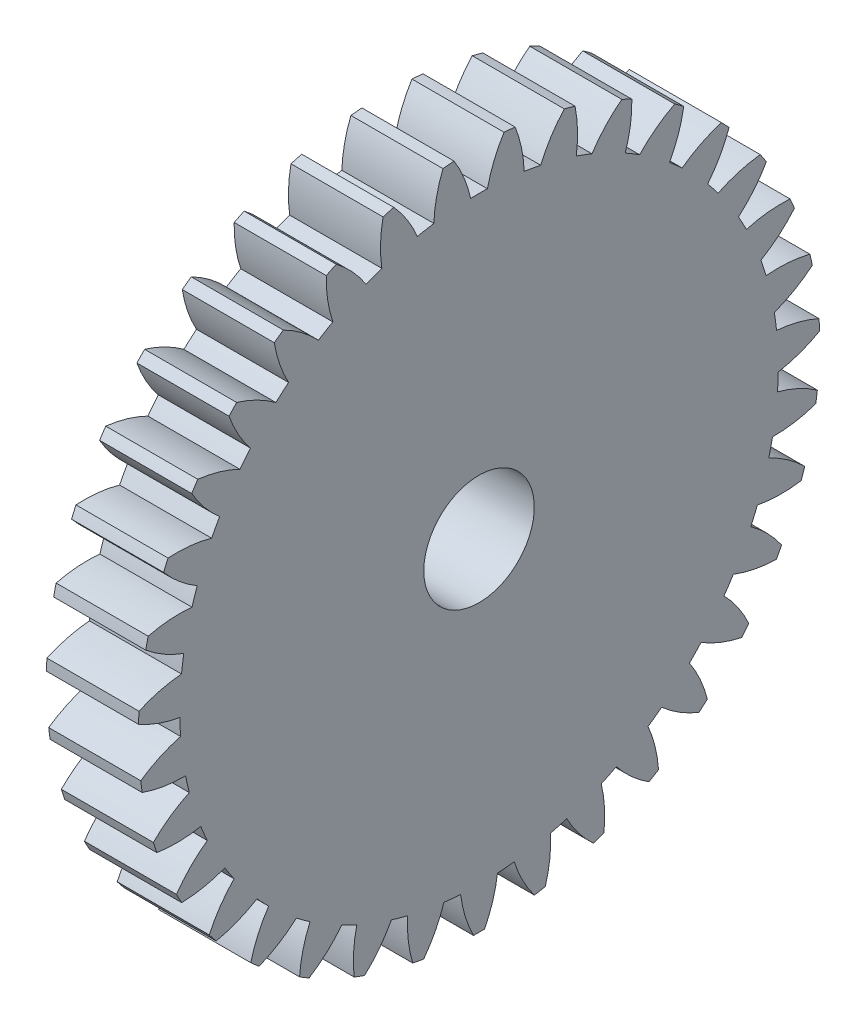
from build123d import *

# Parameters (mm, degrees)
BASPROSKE_W      = 5
BASPROSKE_H      = 18.5
TOOTHCUT_DEPTH   = 27.636441204
TEETHCUTS_COUNT  = 35
TEETHCUTS_ANGLE  = 349.714285714
HUBNEAONESKE_R   = 7
HUBNEARONE_DEPTH = 6.0000508
BORSKE_R         = 3
BORE_DEPTH       = 11.0000508


with BuildPart() as part:
    # BasProSke → Base-Revolve (revolve)
    with BuildSketch(Plane(origin=(0, 0, 0), x_dir=(1, 0, 0), z_dir=(0, 1, 0)), mode=Mode.PRIVATE) as base_revolve_sk:
        with Locations((2.5, 9.25)):
            Rectangle(BASPROSKE_W, BASPROSKE_H)
    revolve(base_revolve_sk.sketch.rotate(Axis((-10, 0, 0), (1, 0, 0)), 180), axis=Axis((-10, 0, 0), (1, 0, 0)))

    # TooCutSke → ToothCut (cut, through all)
    with BuildSketch(Plane(origin=(0, 0, 0), x_dir=(0, 0, -1), z_dir=(1, 0, 0))):
        with BuildLine():
            ThreePointArc((0.456361119, 16.242590173), (0, 16.249), (-0.456361119, 16.242590173))
            ThreePointArc((-0.456361119, 16.242590173), (-0.817781123, 17.39831105), (-1.372969849, 18.474452602))
            ThreePointArc((-1.372969849, 18.474452602), (0, 18.5254), (1.372969849, 18.474452602))
            ThreePointArc((1.372969849, 18.474452602), (0.817781123, 17.39831105), (0.456361119, 16.242590173))
        make_face()
    toothcut = extrude(amount=TOOTHCUT_DEPTH, mode=Mode.SUBTRACT)

    # TeethCuts: ToothCut ×35 about axis
    teethcuts_axis = Axis((-10, 0, 0), (1, 0, 0))
    for i in range(1, TEETHCUTS_COUNT):
        add(toothcut.rotate(teethcuts_axis, i * TEETHCUTS_ANGLE / (TEETHCUTS_COUNT - 1)), mode=Mode.SUBTRACT)

    # HubNeaOneSke → HubNearOne (add)
    with BuildSketch(Plane.ZY):
        with Locations(Location((0, 0, 0), (0, 0, 180))):
            Circle(HUBNEAONESKE_R)
    extrude(amount=HUBNEARONE_DEPTH)

    # BorSke → Bore (cut, symmetric)
    with BuildSketch(Plane(origin=(0, 0, 0), x_dir=(0, 0, -1), z_dir=(1, 0, 0))):
        with Locations(Location((0, 0, 0), (0, 0, 180))):
            Circle(BORSKE_R)
    extrude(amount=BORE_DEPTH, both=True, mode=Mode.SUBTRACT)


solid = part.part
